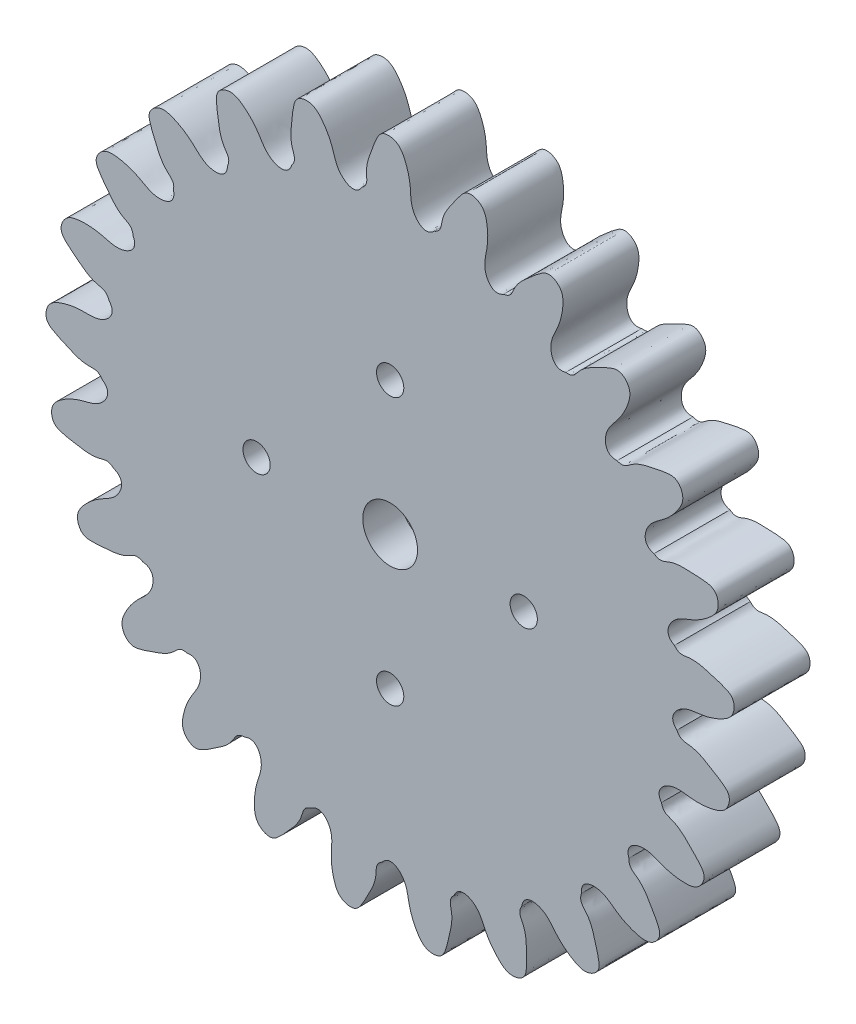
from build123d import *

# Parameters (mm, degrees)
SKETCH_1_R          = 23.77191704
EXTRUDE_1_DEPTH     = 10
SKETCH_2_R          = 23.77191704
EXTRUDE_2_DEPTH     = 5
SKETCH_3_R          = 3.612326464
SKETCH_3_R_2        = 1.797099166
CUT_EXTRUDE_1_DEPTH = 153.560099098


with BuildPart() as part:
    # 草图1 → 凸台-拉伸1 (new body)
    with BuildSketch(Plane.XY):
        with BuildLine():
            add(Edge.make_bspline(
                [(30.404347609, 54.904371903), (30.240149484, 55.166084924), (29.722050386, 55.696411682), (28.01444337, 55.475866025), (26.193753099, 56.191830933), (24.437581154, 56.989516954), (22.740341177, 57.943140647), (23.089801181, 60.11425761), (25.128194316, 61.118111394), (27.461737223, 61.574544256), (30.44934233, 61.248747946), (32.310367515, 63.191717907), (31.290116678, 64.381314193)],
                knots=[0.063534297, 0.063534297, 0.063534297, 0.063534297, 0.103261326, 0.160727717, 0.279368158, 0.365488471, 0.432116112, 0.521172857, 0.596207806, 0.728851627, 0.843783524, 1, 1, 1, 1], degree=3))
            add(Edge.make_bspline(
                [(31.925401573, 45.514756146), (31.701302535, 45.727304857), (31.067615472, 46.111944753), (29.468594378, 45.473857445), (27.527051696, 45.71443712), (25.627683513, 46.050344804), (23.746615462, 46.551926398), (23.545192815, 48.741740728), (25.269752438, 50.220917568), (27.417288462, 51.243768139), (30.389283052, 51.669552848), (31.718998042, 54.020810897), (30.404347609, 54.904371903)],
                knots=[0.063550366, 0.063550366, 0.063550366, 0.063550366, 0.103263996, 0.160725458, 0.279356496, 0.36547013, 0.432092278, 0.521141582, 0.596170443, 0.728803969, 0.843726865, 1, 1, 1, 1], degree=3))
            add(Edge.make_bspline(
                [(35.733907641, 36.798229182), (35.463991985, 36.948366075), (34.754559363, 37.163324994), (33.36446155, 36.147630545), (31.424087122, 35.89780681), (29.500854172, 35.750808407), (27.554145469, 35.768829662), (26.814466075, 37.83975454), (28.116989772, 39.701341348), (29.942678224, 41.226124636), (32.715508984, 42.377679085), (33.418620079, 44.985887388), (31.925401573, 45.514756146)],
                knots=[0.063550346, 0.063550346, 0.063550346, 0.063550346, 0.103263235, 0.160724072, 0.279353848, 0.365466569, 0.432088001, 0.521136345, 0.596164403, 0.728796523, 0.843718198, 1, 1, 1, 1], degree=3))
            add(Edge.make_bspline(
                [(41.590480048, 29.302680698), (41.291706834, 29.380975391), (40.551104336, 29.41275212), (39.457271926, 28.083264518), (37.639986615, 27.35873787), (35.813732574, 26.738069128), (33.92370161, 26.271397459), (32.69224253, 28.093309618), (33.490887252, 30.220335745), (34.880019998, 32.151245277), (37.279359781, 33.956198482), (37.31174245, 36.657325013), (35.733907641, 36.798229182)],
                knots=[0.063550346, 0.063550346, 0.063550346, 0.063550346, 0.103263211, 0.160724029, 0.279353765, 0.365466459, 0.432087868, 0.521136182, 0.596164215, 0.728796292, 0.843717929, 1, 1, 1, 1], degree=3))
            add(Edge.make_bspline(
                [(49.127124767, 23.499088901), (48.818266968, 23.500621943), (48.093029312, 23.347219992), (47.364191779, 21.787475635), (45.784182279, 20.633770843), (44.169657406, 19.57843064), (42.455061765, 18.656388733), (40.809200108, 20.114810752), (41.05378405, 22.373627307), (41.919076959, 24.589337027), (43.794163523, 26.934275927), (43.153785837, 29.558594912), (41.590480048, 29.302680698)],
                knots=[0.063550346, 0.063550346, 0.063550346, 0.063550346, 0.10326321, 0.160724028, 0.279353763, 0.365466455, 0.432087864, 0.521136177, 0.596164209, 0.728796285, 0.84371792, 1, 1, 1, 1], degree=3))
            add(Edge.make_bspline(
                [(57.87028653, 19.752114935), (57.570750813, 19.676790003), (56.906447346, 19.347848185), (56.588400233, 17.655851542), (55.344944352, 16.145460123), (54.043595182, 14.721759365), (52.612169214, 13.402282503), (50.65532052, 14.405576362), (50.330475574, 16.654253595), (50.617559114, 19.015542315), (51.850573797, 21.753125717), (50.577673157, 24.135741441), (49.127124767, 23.499088901)],
                knots=[0.063550346, 0.063550346, 0.063550346, 0.063550346, 0.10326321, 0.160724028, 0.279353763, 0.365466455, 0.432087864, 0.521136177, 0.596164209, 0.728796284, 0.84371792, 1, 1, 1, 1], degree=3))
            add(Edge.make_bspline(
                [(67.27060032, 18.297194959), (66.999207619, 18.149744994), (66.43757897, 17.665931934), (66.550306345, 15.947997376), (65.721534989, 14.175822779), (64.815130078, 12.47321782), (63.756815541, 10.839213588), (61.61193581, 11.324338644), (60.738073177, 13.421583893), (60.428908835, 15.780083159), (60.942376787, 18.738298627), (59.116934225, 20.729502581), (57.87028653, 19.752114935)],
                knots=[0.063550346, 0.063550346, 0.063550346, 0.063550346, 0.10326321, 0.160724028, 0.279353763, 0.365466455, 0.432087864, 0.521136177, 0.596164209, 0.728796284, 0.84371792, 1, 1, 1, 1], degree=3))
            add(Edge.make_bspline(
                [(76.737409852, 19.225746945), (76.511212766, 19.015436772), (76.08754813, 18.407152224), (76.623966919, 16.771223897), (76.261954839, 14.848618368), (75.80744694, 12.97409014), (75.188741628, 11.128229032), (72.990601543, 11.064703095), (71.622629228, 12.878738729), (70.736642936, 15.086255358), (70.498301076, 18.079227334), (68.235015863, 19.553904849), (67.27060032, 18.297194959)],
                knots=[0.063550346, 0.063550346, 0.063550346, 0.063550346, 0.10326321, 0.160724028, 0.279353763, 0.365466455, 0.432087864, 0.521136177, 0.596164209, 0.728796284, 0.84371792, 1, 1, 1, 1], degree=3))
            add(Edge.make_bspline(
                [(85.675880666, 22.479426557), (85.50909199, 22.219470737), (85.250011773, 21.524935456), (86.17641681, 20.073804754), (86.303910558, 18.12157267), (86.329858074, 16.192904675), (86.189637518, 14.251168934), (84.076354304, 13.642983572), (82.300227037, 15.059827059), (80.893088572, 16.977654663), (79.917912798, 19.817323711), (77.358995466, 20.682815376), (76.737409852, 19.225746945)],
                knots=[0.063550346, 0.063550346, 0.063550346, 0.063550346, 0.10326321, 0.160724028, 0.279353763, 0.365466455, 0.432087864, 0.521136177, 0.596164209, 0.728796284, 0.84371792, 1, 1, 1, 1], degree=3))
            add(Edge.make_bspline(
                [(93.524375766, 27.85379314), (93.427475448, 27.560525653), (93.349258613, 26.823379845), (94.607440462, 25.648226646), (95.216429136, 23.789033929), (95.721201689, 21.92741147), (96.068276462, 20.011807494), (94.172635475, 18.897177229), (92.099953866, 19.827803083), (90.260078913, 21.335437501), (88.609343104, 23.84337677), (85.915579841, 24.04530056), (85.675880666, 22.479426557)],
                knots=[0.063550346, 0.063550346, 0.063550346, 0.063550346, 0.10326321, 0.160724028, 0.279353763, 0.365466455, 0.432087864, 0.521136177, 0.596164209, 0.728796284, 0.84371792, 1, 1, 1, 1], degree=3))
            add(Edge.make_bspline(
                [(99.789745342, 35.011155474), (99.768821983, 34.703003395), (99.876383182, 33.969564642), (101.387285651, 33.144228145), (102.439504253, 31.49489471), (103.391385128, 29.817290374), (104.203947245, 28.048182605), (102.64505858, 26.497143756), (100.406056836, 26.883077332), (98.249051505, 27.885788348), (96.026477463, 29.904414791), (93.367127322, 29.430083092), (93.524375766, 27.85379314)],
                knots=[0.063550346, 0.063550346, 0.063550346, 0.063550346, 0.10326321, 0.160724028, 0.279353763, 0.365466455, 0.432087864, 0.521136177, 0.596164209, 0.728796284, 0.84371792, 1, 1, 1, 1], degree=3))
            add(Edge.make_bspline(
                [(104.07831318, 43.501790162), (104.134681472, 43.19811582), (104.421262239, 42.514468776), (106.08994977, 42.090807907), (107.519283535, 40.754967441), (108.858462554, 39.366791276), (110.08545575, 37.855339263), (108.961270116, 35.965349305), (106.696632951, 35.782340978), (104.35802982, 36.21712457), (101.703270046, 37.619600464), (99.245429777, 36.498817281), (99.789745342, 35.011155474)],
                knots=[0.063550346, 0.063550346, 0.063550346, 0.063550346, 0.10326321, 0.160724028, 0.279353763, 0.365466455, 0.432087864, 0.521136177, 0.596164209, 0.728796284, 0.84371792, 1, 1, 1, 1], degree=3))
            add(Edge.make_bspline(
                [(106.120612791, 52.7921994), (106.250730907, 52.512083769), (106.698324318, 51.921184493), (108.419947135, 51.925819424), (110.136585767, 50.987407695), (111.778917389, 49.975883916), (113.343245167, 48.817057746), (112.724399281, 46.706871701), (110.576422178, 45.966420555), (108.203164282, 45.805957672), (105.283027096, 46.504160298), (103.181131842, 44.807348561), (104.07831318, 43.501790162)],
                knots=[0.063550346, 0.063550346, 0.063550346, 0.063550346, 0.10326321, 0.160724028, 0.279353763, 0.365466455, 0.432087864, 0.521136177, 0.596164209, 0.728796284, 0.84371792, 1, 1, 1, 1], degree=3))
            add(Edge.make_bspline(
                [(105.788318978, 62.298632607), (105.98401112, 62.059676384), (106.564493235, 61.59865325), (108.230875445, 62.03129275), (110.126956225, 61.549273619), (111.969246712, 60.977959986), (113.772616607, 60.244572969), (113.697994832, 58.046781585), (111.801643091, 56.79541289), (109.542850952, 56.049786006), (106.540819313, 55.999844725), (104.926938883, 53.833621355), (106.120612791, 52.7921994)],
                knots=[0.063550346, 0.063550346, 0.063550346, 0.063550346, 0.10326321, 0.160724028, 0.279353763, 0.365466455, 0.432087864, 0.521136177, 0.596164209, 0.728796284, 0.84371792, 1, 1, 1, 1], degree=3))
            add(Edge.make_bspline(
                [(103.102310986, 71.423765623), (103.351281095, 71.240983306), (104.028178088, 70.938804094), (105.534614768, 71.772263832), (107.490999967, 71.776924333), (109.417491434, 71.681718582), (111.346591081, 71.419852123), (111.820882178, 69.272550716), (110.295310554, 67.588892569), (108.292912389, 66.304952162), (105.397614986, 65.510004969), (104.373155423, 63.010481748), (105.788318978, 62.298632607)],
                knots=[0.063550346, 0.063550346, 0.063550346, 0.063550346, 0.10326321, 0.160724028, 0.279353763, 0.365466455, 0.432087864, 0.521136177, 0.596164209, 0.728796284, 0.84371792, 1, 1, 1, 1], degree=3))
            add(Edge.make_bspline(
                [(98.231360573, 79.594232782), (98.517964942, 79.479109255), (99.248744886, 79.354760995), (100.50058108, 80.536671631), (102.39434382, 81.027718928), (104.283987723, 81.414603187), (106.217604697, 81.640711317), (107.211007212, 79.678822732), (106.15207298, 77.668665567), (104.531886831, 75.927086335), (101.925245848, 74.437082686), (101.554577713, 71.761313849), (103.102310986, 71.423765623)],
                knots=[0.063550346, 0.063550346, 0.063550346, 0.063550346, 0.10326321, 0.160724028, 0.279353763, 0.365466455, 0.432087864, 0.521136177, 0.596164209, 0.728796284, 0.84371792, 1, 1, 1, 1], degree=3))
            add(Edge.make_bspline(
                [(91.481527469, 86.296653581), (91.787757691, 86.25642248), (92.526502994, 86.317718431), (93.445081229, 87.773816172), (95.157229434, 88.720395958), (96.891292496, 89.565060865), (98.707930532, 90.264936381), (100.158025331, 88.611733292), (99.632265224, 86.401382676), (98.496093345, 84.311594448), (96.341893621, 82.220156751), (96.648307357, 79.536270696), (98.231360573, 79.594232782)],
                knots=[0.063550346, 0.063550346, 0.063550346, 0.063550346, 0.10326321, 0.160724028, 0.279353763, 0.365466455, 0.432087864, 0.521136177, 0.596164209, 0.728796284, 0.84371792, 1, 1, 1, 1], degree=3))
            add(Edge.make_bspline(
                [(83.276928512, 91.109890273), (83.583543016, 91.147079466), (84.283835594, 91.390168178), (84.811438222, 93.028961049), (86.234391322, 94.371596234), (87.703915984, 95.620968387), (89.289429033, 96.750635534), (91.105101326, 95.509994772), (91.145550785, 93.238335163), (90.564783033, 90.931647019), (88.99838086, 88.370187997), (89.962623365, 85.846823156), (91.481527469, 86.296653581)],
                knots=[0.063550346, 0.063550346, 0.063550346, 0.063550346, 0.10326321, 0.160724028, 0.279353763, 0.365466455, 0.432087864, 0.521136177, 0.596164209, 0.728796284, 0.84371792, 1, 1, 1, 1], degree=3))
            add(Edge.make_bspline(
                [(74.133088828, 93.731509495), (74.420821898, 93.843782247), (75.038659792, 94.253389562), (75.142135599, 95.971906179), (76.186484219, 97.626234057), (77.299134841, 99.201810809), (78.553899286, 100.690288446), (80.621063707, 99.940164034), (81.225181144, 97.74993216), (81.236309293, 95.371281799), (80.35612748, 92.500747342), (81.917611851, 90.296456008), (83.276928512, 91.109890273)],
                knots=[0.063550346, 0.063550346, 0.063550346, 0.063550346, 0.10326321, 0.160724028, 0.279353763, 0.365466455, 0.432087864, 0.521136177, 0.596164209, 0.728796284, 0.84371792, 1, 1, 1, 1], degree=3))
            add(Edge.make_bspline(
                [(64.624549494, 93.996785268), (64.875321802, 94.177087071), (65.371883986, 94.727475855), (65.044731206, 96.417735499), (65.64485508, 98.279808565), (66.330719733, 100.082590633), (67.17589411, 101.836352237), (69.364663115, 101.623877249), (70.494489609, 99.652693434), (71.096814437, 97.351540206), (70.958158044, 94.352296552), (73.018770476, 92.605582456), (74.133088828, 93.731509495)],
                knots=[0.063550346, 0.063550346, 0.063550346, 0.063550346, 0.10326321, 0.160724028, 0.279353763, 0.365466455, 0.432087864, 0.521136177, 0.596164209, 0.728796284, 0.84371792, 1, 1, 1, 1], degree=3))
            add(Edge.make_bspline(
                [(55.348767008, 91.889049345), (55.546821608, 92.126051171), (55.890907252, 92.782638471), (55.153682096, 94.338435912), (55.271873236, 96.291253266), (55.48785652, 98.207965224), (55.870335414, 100.116815503), (58.043180597, 100.455340524), (59.627724994, 98.827061497), (60.783400217, 96.747995322), (61.394981535, 93.80849598), (63.82524617, 92.629111592), (64.624549494, 93.996785268)],
                knots=[0.063550346, 0.063550346, 0.063550346, 0.063550346, 0.10326321, 0.160724028, 0.279353762, 0.365466455, 0.432087864, 0.521136177, 0.596164209, 0.728796284, 0.84371792, 1, 1, 1, 1], degree=3))
            add(Edge.make_bspline(
                [(46.888572944, 87.540738644), (47.021465314, 87.819548762), (47.191454241, 88.541078733), (46.09047922, 89.864657439), (45.719311294, 91.785516408), (45.451842172, 93.695724191), (45.347593022, 95.639723067), (47.367986537, 96.507977328), (49.307686086, 95.324913841), (50.944096381, 93.598570095), (52.267487499, 90.903514607), (54.914701883, 90.365564999), (55.348767008, 91.889049345)],
                knots=[0.063550346, 0.063550346, 0.063550346, 0.063550346, 0.103263205, 0.160724023, 0.279353759, 0.365466452, 0.432087861, 0.521136175, 0.596164207, 0.728796283, 0.843717919, 1, 1, 1, 1], degree=3))
            add(Edge.make_bspline(
                [(39.775552868, 81.225077603), (39.834932509, 81.528176075), (39.82014374, 82.269310688), (38.424595845, 83.277503158), (37.587392136, 85.045710164), (36.853276303, 86.829388222), (36.268849245, 88.686387216), (38.009842572, 90.029815247), (40.182818874, 89.366303335), (42.197142636, 88.101154545), (44.149189935, 85.819882846), (46.847020269, 85.95716932), (46.888572944, 87.540738644)],
                knots=[0.063550357, 0.063550357, 0.063550357, 0.063550357, 0.103263048, 0.160723883, 0.279353636, 0.365466338, 0.432087761, 0.521136094, 0.596164139, 0.72879623, 0.843717881, 1, 1, 1, 1], degree=3))
            add(Edge.make_bspline(
                [(34.456625648, 73.339033286), (34.438759766, 73.647332637), (34.240137275, 74.361452754), (32.637680309, 74.990832031), (31.387081743, 76.495328542), (30.232436094, 78.040393512), (29.204544979, 79.693712515), (30.556751273, 81.427907982), (32.826471612, 81.325632918), (35.092143685, 80.601173707), (37.550192517, 78.877015807), (40.129137204, 79.680914946), (39.775552868, 81.225077603)],
                knots=[0.063550701, 0.063550701, 0.063550701, 0.063550701, 0.103258001, 0.160719375, 0.279349684, 0.365462705, 0.432084548, 0.521133493, 0.596161959, 0.728794545, 0.843716668, 1, 1, 1, 1], degree=3))
            add(Edge.make_bspline(
                [(31.290116678, 64.381314193), (31.192941052, 64.678329309), (30.80835394, 65.322364058), (29.094705272, 65.514864859), (27.508585937, 66.674125083), (26.005076427, 67.880400768), (24.598358279, 69.226872857), (25.476811615, 71.242898403), (27.700850196, 71.708184423), (30.075555628, 71.569954461), (32.885238545, 70.510916371), (35.183633497, 71.931104474), (34.456625648, 73.339033286)],
                knots=[0.063561786, 0.063561786, 0.063561786, 0.063561786, 0.103726473, 0.161355209, 0.279919365, 0.365959892, 0.432531128, 0.52151269, 0.596482253, 0.729002541, 0.843828746, 1, 1, 1, 1], degree=3))
        make_face()
        with Locations((68.328882175, 56.230227817)):
            Circle(SKETCH_1_R, mode=Mode.SUBTRACT)
    extrude(amount=EXTRUDE_1_DEPTH)

    # 草图2 → 凸台-拉伸2 (add)
    with BuildSketch(Plane.XY.offset(5)):
        with Locations((68.328882175, 56.230227817)):
            Circle(SKETCH_2_R)
    extrude(amount=EXTRUDE_2_DEPTH)

    # 草图3 → 切除-拉伸1 (cut, through all)
    with BuildSketch(Plane(origin=(0, 0, 5), x_dir=(-1, 0, 0), z_dir=(0, 0, -1))):
        with Locations((-68.328882175, 56.230227817)):
            Circle(SKETCH_3_R)
        with Locations((-68.328882175, 73.831089423)):
            Circle(SKETCH_3_R_2)
        with Locations((-50.728020569, 56.230227817)):
            Circle(SKETCH_3_R_2)
        with Locations((-68.328882175, 38.629366211)):
            Circle(SKETCH_3_R_2)
        with Locations((-85.929743781, 56.230227817)):
            Circle(SKETCH_3_R_2)
    extrude(amount=-CUT_EXTRUDE_1_DEPTH, mode=Mode.SUBTRACT)


solid = part.part
